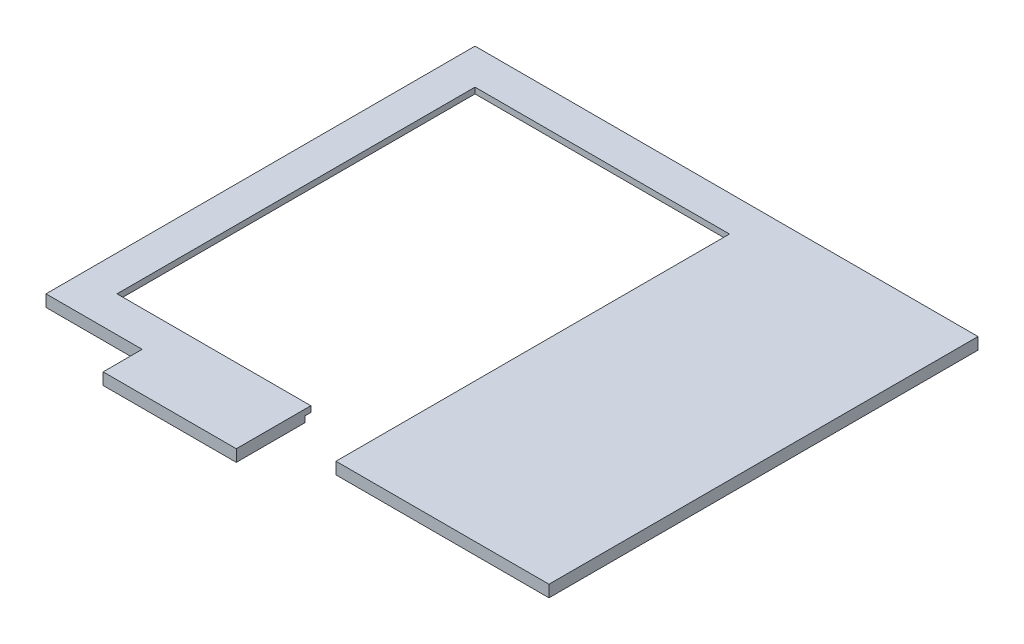
from build123d import *

# Parameters (mm, degrees)
SKETCH1_W           = 90
SKETCH1_H           = 125
BOSS_EXTRUDE1_DEPTH = 4
SKETCH2_W           = 90
SKETCH2_H           = 125
SKETCH2_W_2         = 86
SKETCH2_H_2         = 121
BOSS_EXTRUDE2_DEPTH = 2
SKETCH3_W           = 20.5
SKETCH3_H           = 12
CUT_EXTRUDE1_DEPTH  = 10


with BuildPart() as part:
    # Sketch1 → Boss-Extrude1 (new body)
    with BuildSketch(Plane(origin=(0, 55.343226389, 0), x_dir=(1, 0, 0), z_dir=(0, 1, 0))):
        Polygon((-104.681843773, -215.861584775), (-104.681843773, -229.045240407), (-59.681843773, -229.045240407), (-59.681843773, -215.861584775), (32.818156227, -215.861584775), (32.818156227, -70.861584775), (-137.181843773, -70.861584775), (-137.181843773, -215.861584775), align=None)
        with Locations((-82.181843773, -143.361584775)):
            Rectangle(SKETCH1_W, SKETCH1_H, mode=Mode.SUBTRACT)
    extrude(amount=BOSS_EXTRUDE1_DEPTH)

    # Sketch2 → Boss-Extrude2 (add)
    with BuildSketch(Plane(origin=(0, 59.343226389, 0), x_dir=(1, 0, 0), z_dir=(0, 1, 0))):
        with Locations((-82.181843773, -143.361584775)):
            Rectangle(SKETCH2_W, SKETCH2_H)
        with Locations((-82.181843773, -143.361584775)):
            Rectangle(SKETCH2_W_2, SKETCH2_H_2, mode=Mode.SUBTRACT)
    extrude(amount=-BOSS_EXTRUDE2_DEPTH)

    # Sketch3 → Cut-Extrude1 (cut)
    with BuildSketch(Plane(origin=(0, 59.343226389, 0), x_dir=(1, 0, 0), z_dir=(0, 1, 0))):
        with Locations((-49.431843773, -209.861584775)):
            Rectangle(SKETCH3_W, SKETCH3_H)
    extrude(amount=-CUT_EXTRUDE1_DEPTH, mode=Mode.SUBTRACT)


solid = part.part
